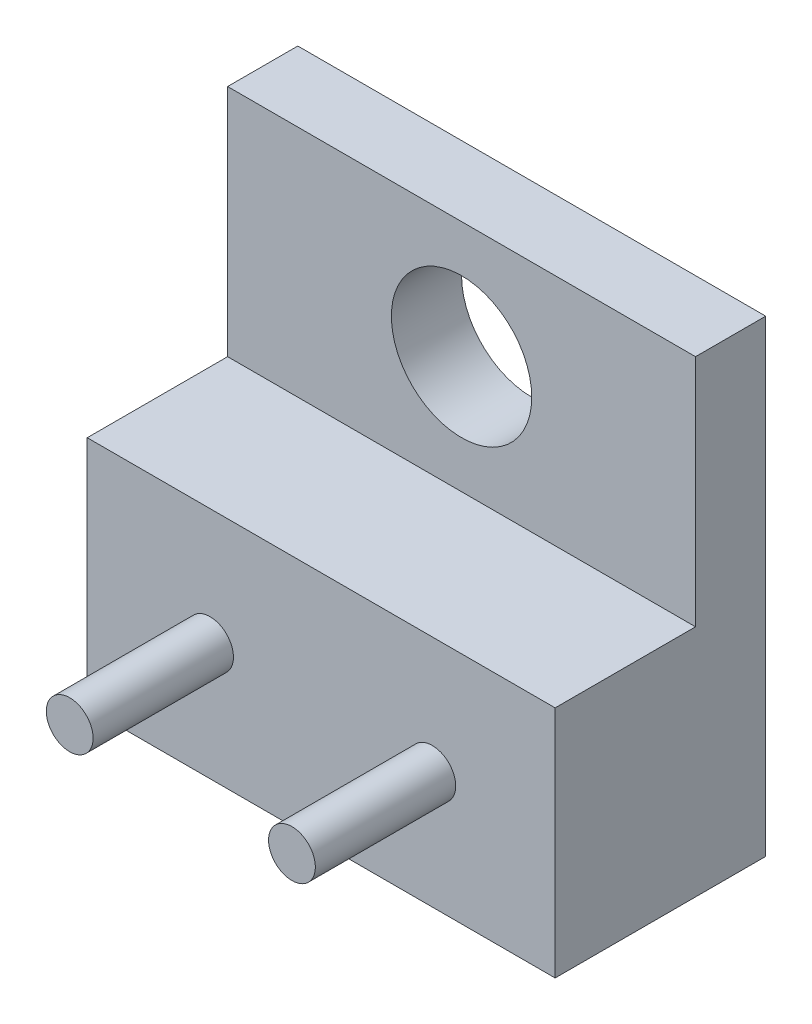
from build123d import *

# Parameters (mm, degrees)
SKETCH_1_W          = 20
SKETCH_1_H          = 20
EXTRUDE_1_DEPTH     = 9
SKETCH_2_R          = 1
EXTRUDE_2_DEPTH     = 6
SKETCH_3_W          = 20
SKETCH_3_H          = 10
CUT_EXTRUDE_1_DEPTH = 6
CUT_EXTRUDE_2_REACH = 32.725
SKETCH_4_R          = 3


with BuildPart() as part:
    # 草图1 → 凸台-拉伸1 (new body)
    with BuildSketch(Plane.XY):
        with Locations((10, 10)):
            Rectangle(SKETCH_1_W, SKETCH_1_H)
    extrude(amount=EXTRUDE_1_DEPTH)

    # 草图2 → 凸台-拉伸2 (add)
    with BuildSketch(Plane.XY.offset(9)):
        with Locations(Location((5.25, 5, 0), (0, 0, 180))):
            Circle(SKETCH_2_R)
        with Locations(Location((14.749981105, 4.981052524, 0), (0, 0, 180))):
            Circle(SKETCH_2_R)
    extrude(amount=EXTRUDE_2_DEPTH)

    # 草图3 → 切除-拉伸1 (cut)
    with BuildSketch(Plane.XY.offset(9)):
        with Locations((10, 15)):
            Rectangle(SKETCH_3_W, SKETCH_3_H)
    extrude(amount=-CUT_EXTRUDE_1_DEPTH, mode=Mode.SUBTRACT)

    # 草图4 → 切除-拉伸2 (cut, up to next)
    with BuildSketch(Plane.XY.offset(3), mode=Mode.PRIVATE) as cut_extrude_2_sk1:
        with Locations((10, 15)):
            Circle(SKETCH_4_R)
    cut_extrude_2_tool1 = extrude(cut_extrude_2_sk1.sketch, amount=-CUT_EXTRUDE_2_REACH, mode=Mode.PRIVATE) & part.part
    add(cut_extrude_2_tool1.solids().sort_by_distance((10, 15, 3))[0], mode=Mode.SUBTRACT)


solid = part.part
